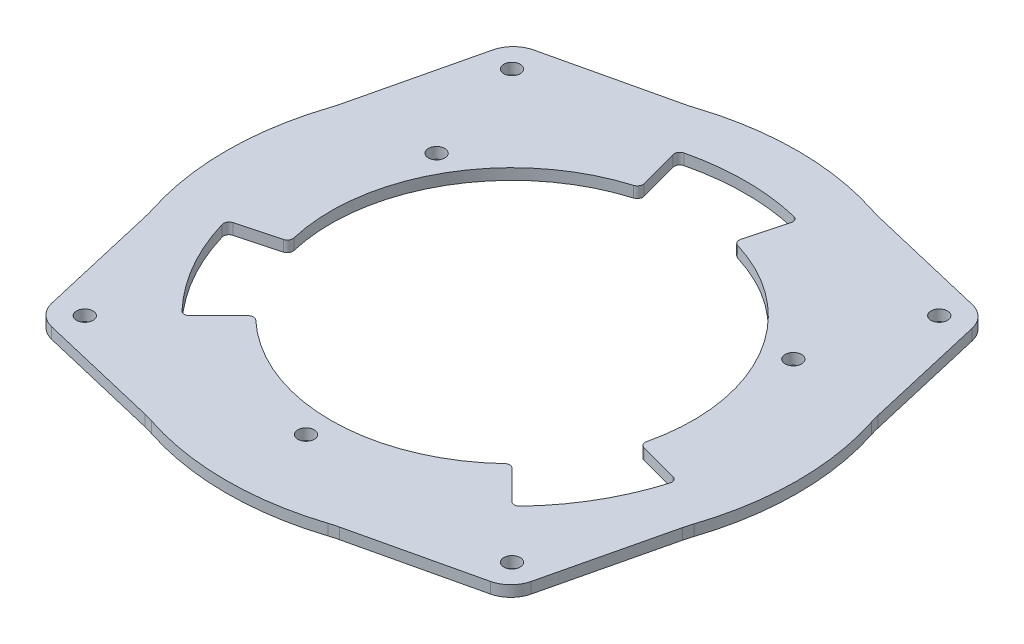
from build123d import *

# Parameters (mm, degrees)
SKETCH1_R           = 1.5
SKETCH1_R_2         = 33
BOSS_EXTRUDE1_DEPTH = 2
CUT_EXTRUDE1_DEPTH  = 74.566296631
FILLET1_R           = 1


with BuildPart() as part:
    # Sketch1 → Boss-Extrude1 (new body)
    with BuildSketch(Plane(origin=(0, 0, 0), x_dir=(1, 0, 0), z_dir=(0, 1, 0))):
        with BuildLine():
            Line((17.897079586, 48.929734976), (40.149284407, 43.651218265))
            ThreePointArc((40.149284407, 43.651218265), (42.540265174, 42.312242187), (43.866371506, 39.91409958))
            Line((43.866371506, 39.91409958), (49.02521675, 17.633846579))
            ThreePointArc((49.02521675, 17.633846579), (49.23478351, 16.809026698), (49.479249782, 15.993868858))
            ThreePointArc((49.479249782, 15.993868858), (51.999812242, -0.139738387), (49.392575566, -16.259565766))
            ThreePointArc((49.392575566, -16.259565766), (49.143731732, -17.073397941), (48.929734976, -17.897079586))
            Line((48.929734976, -17.897079586), (43.651218265, -40.149284407))
            ThreePointArc((43.651218265, -40.149284407), (42.312242187, -42.540265174), (39.91409958, -43.866371506))
            Line((39.91409958, -43.866371506), (17.633846579, -49.02521675))
            ThreePointArc((17.633846579, -49.02521675), (16.809026698, -49.23478351), (15.993868858, -49.479249782))
            ThreePointArc((15.993868858, -49.479249782), (-0.139738387, -51.999812242), (-16.259565766, -49.392575566))
            ThreePointArc((-16.259565766, -49.392575566), (-17.073397941, -49.143731732), (-17.897079586, -48.929734976))
            Line((-17.897079586, -48.929734976), (-40.149284407, -43.651218265))
            ThreePointArc((-40.149284407, -43.651218265), (-42.540265174, -42.312242187), (-43.866371506, -39.91409958))
            Line((-43.866371506, -39.91409958), (-49.02521675, -17.633846579))
            ThreePointArc((-49.02521675, -17.633846579), (-49.23478351, -16.809026698), (-49.479249782, -15.993868858))
            ThreePointArc((-49.479249782, -15.993868858), (-51.999812242, 0.139738387), (-49.392575566, 16.259565766))
            ThreePointArc((-49.392575566, 16.259565766), (-49.143731732, 17.073397941), (-48.929734976, 17.897079586))
            Line((-48.929734976, 17.897079586), (-43.651218265, 40.149284407))
            ThreePointArc((-43.651218265, 40.149284407), (-42.312242187, 42.540265174), (-39.91409958, 43.866371506))
            Line((-39.91409958, 43.866371506), (-17.633846579, 49.02521675))
            ThreePointArc((-17.633846579, 49.02521675), (-16.809026698, 49.23478351), (-15.993868858, 49.479249782))
            ThreePointArc((-15.993868858, 49.479249782), (-8.026622704, 51.3767781), (0.139738387, 51.999812242))
            ThreePointArc((0.139738387, 51.999812242), (8.302633013, 51.332896714), (16.259565766, 49.392575566))
            ThreePointArc((16.259565766, 49.392575566), (17.073397941, 49.143731732), (17.897079586, 48.929734976))
        make_face()
        with Locations(Location((-38.8907, 38.8907, 0), (0, 0, 270))):
            Circle(SKETCH1_R, mode=Mode.SUBTRACT)
        with Locations(Location((38.8907, 38.8907, 0), (0, 0, 90))):
            Circle(SKETCH1_R, mode=Mode.SUBTRACT)
        with Locations(Location((38.8907, -38.8907, 0), (0, 0, 270))):
            Circle(SKETCH1_R, mode=Mode.SUBTRACT)
        with Locations(Location((-38.8907, -38.8907, 0), (0, 0, 90))):
            Circle(SKETCH1_R, mode=Mode.SUBTRACT)
        with Locations(Location((0, 0, 0), (0, 0, 270))):
            Circle(SKETCH1_R_2, mode=Mode.SUBTRACT)
        with Locations(Location((-32.475952642, 18.75, 0), (0, 0, 270))):
            Circle(SKETCH1_R, mode=Mode.SUBTRACT)
        with Locations(Location((0, -37.5, 0), (0, 0, 270))):
            Circle(SKETCH1_R, mode=Mode.SUBTRACT)
        with Locations(Location((32.475952642, 18.75, 0), (0, 0, 270))):
            Circle(SKETCH1_R, mode=Mode.SUBTRACT)
    extrude(amount=BOSS_EXTRUDE1_DEPTH)

    # Sketch2 → Cut-Extrude1 (cut, through all)
    with BuildSketch(Plane(origin=(0, 2, 0), x_dir=(1, 0, 0), z_dir=(0, 1, 0))):
        with BuildLine():
            Line((-8.541028488, 31.875552268), (-10.999809417, 41.051847617))
            ThreePointArc((-10.999809417, 41.051847617), (0, 42.5), (10.999809417, 41.051847617))
            Line((10.999809417, 41.051847617), (8.541028488, 31.875552268))
            ThreePointArc((8.541028488, 31.875552268), (0, 33), (-8.541028488, 31.875552268))
        make_face()
        with BuildLine():
            Line((-31.875552268, -8.541028488), (-41.051847617, -10.999809417))
            ThreePointArc((-41.051847617, -10.999809417), (-36.806079661, -21.25), (-30.0520382, -30.0520382))
            Line((-30.0520382, -30.0520382), (-23.334523779, -23.334523779))
            ThreePointArc((-23.334523779, -23.334523779), (-28.578838325, -16.5), (-31.875552268, -8.541028488))
        make_face()
        with BuildLine():
            Line((23.334523779, -23.334523779), (30.0520382, -30.0520382))
            ThreePointArc((30.0520382, -30.0520382), (36.806079661, -21.25), (41.051847617, -10.999809417))
            Line((41.051847617, -10.999809417), (31.875552268, -8.541028488))
            ThreePointArc((31.875552268, -8.541028488), (28.578838325, -16.5), (23.334523779, -23.334523779))
        make_face()
    extrude(amount=-CUT_EXTRUDE1_DEPTH, mode=Mode.SUBTRACT)

    # Fillet1
    fillet1_edges = [part.edges().sort_by_distance(p)[0] for p in [
        (8.541028488, 1, -31.875552268),
        (-8.541028488, 1, -31.875552268),
        (-10.999809417, 1, -41.051847617),
        (10.999809417, 1, -41.051847617),
        (-31.875552268, 1, 8.541028488),
        (-23.334523779, 1, 23.334523779),
        (-30.0520382, 1, 30.0520382),
        (-41.051847617, 1, 10.999809417),
        (23.334523779, 1, 23.334523779),
        (31.875552268, 1, 8.541028488),
        (41.051847617, 1, 10.999809417),
        (30.0520382, 1, 30.0520382),
    ]]
    fillet(fillet1_edges, radius=FILLET1_R)


solid = part.part
